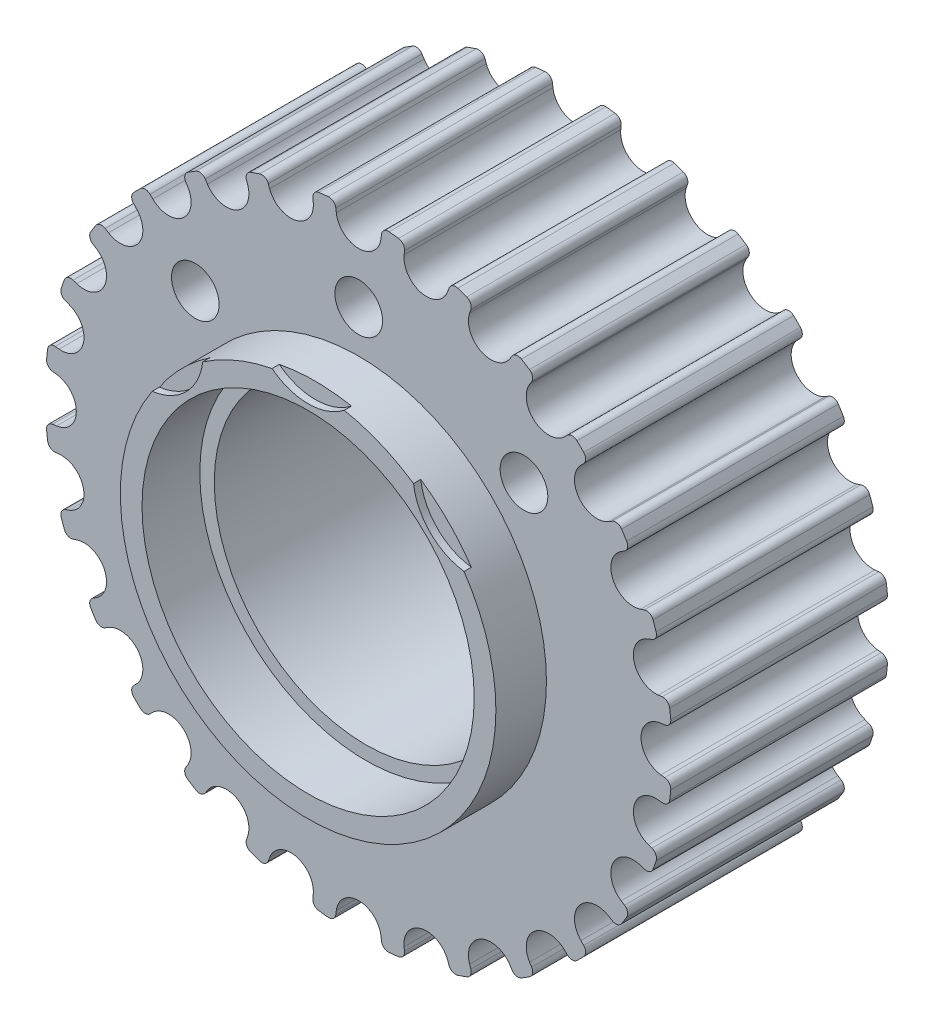
from build123d import *

# Parameters (mm, degrees)
SKETCH_2_R           = 10.5
EXTRUDE_1_DEPTH      = 15
EXTRUDE_2_DEPTH      = 3.5
EXTRUDE_2_DEPTH_BACK = 19.5
SKETCH_12_R          = 13
SKETCH_12_R_2        = 11.5
HOLE_WIZARD_M4_1_D   = 3.3
CUT_EXTRUDE_START    = -0.5
SKETCH_14_R          = 11.5
SKETCH_14_R_2        = 10.5
CUT_EXTRUDE_1_DEPTH  = 0.5
CUT_EXTRUDE_START_2  = 3.5
SKETCH_15_R          = 4.05
CUT_EXTRUDE_2_DEPTH  = 0.5
CUT_EXTRUDE_START_3  = -18
SKETCH_15_2_R        = 4.05
CUT_EXTRUDE_3_DEPTH  = 1.5
EXTRUDE_START        = 0.5
SKETCH_16_R          = 11.5
SKETCH_16_R_2        = 10.5
EXTRUDE_3_DEPTH      = 0.5


with BuildPart() as part:
    # 草图2 → 凸台-拉伸1 (new body)
    with BuildSketch(Plane.XY):
        with BuildLine():
            Line((1.331903556, 20.780403486), (1.298918642, 20.511762921))
            ThreePointArc((1.298918642, 20.511762921), (-0.249453355, 19.141879097), (-1.797825351, 20.511762921))
            Line((-1.797825351, 20.511762921), (-1.830810265, 20.780403486))
            ThreePointArc((-1.830810265, 20.780403486), (-2.006994407, 21.096415396), (-2.353762187, 21.19964565))
            ThreePointArc((-2.353762187, 21.19964565), (-2.679978202, 21.165383749), (-3.00563929, 21.12619674))
            ThreePointArc((-3.00563929, 21.12619674), (-3.320741986, 20.948391594), (-3.422189558, 20.601098103))
            Line((-3.422189558, 20.601098103), (-3.394569322, 20.331853084))
            ThreePointArc((-3.394569322, 20.331853084), (-4.599292572, 18.651769924), (-6.413671477, 19.642762718))
            Line((-6.413671477, 19.642762718), (-6.50560754, 19.897328069))
            ThreePointArc((-6.50560754, 19.897328069), (-6.747693643, 20.166212241), (-7.108738124, 20.189691206))
            ThreePointArc((-7.108738124, 20.189691206), (-7.419151232, 20.083698431), (-7.727927386, 19.973027513))
            ThreePointArc((-7.727927386, 19.973027513), (-7.995564432, 19.729563367), (-8.01718843, 19.36840304))
            Line((-8.01718843, 19.36840304), (-7.930348038, 19.112054636))
            ThreePointArc((-7.930348038, 19.112054636), (-8.731012687, 17.206018527), (-10.720417968, 17.768427773))
            Line((-10.720417968, 17.768427773), (-10.866695121, 17.996152941))
            ThreePointArc((-10.866695121, 17.996152941), (-11.162543977, 18.2044264), (-11.51976088, 18.146976743))
            ThreePointArc((-11.51976088, 18.146976743), (-11.798805672, 17.974568014), (-12.075213567, 17.797962688))
            ThreePointArc((-12.075213567, 17.797962688), (-12.281964525, 17.501047851), (-12.222680631, 17.144130775))
            Line((-12.222680631, 17.144130775), (-12.080974622, 16.913533367))
            ThreePointArc((-12.080974622, 16.913533367), (-12.437432001, 14.877120916), (-14.502106569, 14.982745068))
            Line((-14.502106569, 14.982745068), (-14.695389866, 15.172210962))
            ThreePointArc((-14.695389866, 15.172210962), (-15.030166378, 15.309430006), (-15.365643356, 15.173932493))
            ThreePointArc((-15.365643356, 15.173932493), (-15.599327361, 14.943753103), (-15.829506751, 14.710069098))
            ThreePointArc((-15.829506751, 14.710069098), (-15.965004264, 14.37459212), (-15.82778522, 14.039815608))
            Line((-15.82778522, 14.039815608), (-15.638319326, 13.846532311))
            ThreePointArc((-15.638319326, 13.846532311), (-15.532695174, 11.781857744), (-17.569107624, 11.425400364))
            Line((-17.569107624, 11.425400364), (-17.799705033, 11.567106373))
            ThreePointArc((-17.799705033, 11.567106373), (-18.156622109, 11.626390267), (-18.453536946, 11.41963931))
            ThreePointArc((-18.453536946, 11.41963931), (-18.630142271, 11.143231414), (-18.802551001, 10.864186622))
            ThreePointArc((-18.802551001, 10.864186622), (-18.860000658, 10.506969719), (-18.651727199, 10.211120863))
            Line((-18.651727199, 10.211120863), (-18.424002031, 10.06484371))
            ThreePointArc((-18.424002031, 10.06484371), (-17.861592784, 8.075438429), (-19.767628894, 7.27477378))
            Line((-19.767628894, 7.27477378), (-20.023977298, 7.361614172))
            ThreePointArc((-20.023977298, 7.361614172), (-20.385137624, 7.339990175), (-20.628601771, 7.072353128))
            ThreePointArc((-20.628601771, 7.072353128), (-20.739272689, 6.763576974), (-20.845265464, 6.453163866))
            ThreePointArc((-20.845265464, 6.453163866), (-20.821786499, 6.092119385), (-20.552902327, 5.850033282))
            Line((-20.552902327, 5.850033282), (-20.298336976, 5.75809722))
            ThreePointArc((-20.298336976, 5.75809722), (-19.307344182, 3.943718314), (-20.987427341, 2.738995064))
            Line((-20.987427341, 2.738995064), (-21.25667236, 2.7666153))
            ThreePointArc((-21.25667236, 2.7666153), (-21.603965852, 2.665167728), (-21.781770998, 2.350065032))
            ThreePointArc((-21.781770998, 2.350065032), (-21.820958007, 2.024403944), (-21.855219907, 1.69818793))
            ThreePointArc((-21.855219907, 1.69818793), (-21.751989654, 1.351420149), (-21.435977744, 1.175236007))
            Line((-21.435977744, 1.175236007), (-21.167337179, 1.142251093))
            ThreePointArc((-21.167337179, 1.142251093), (-19.797453355, -0.406120903), (-21.167337179, -1.9544929))
            Line((-21.167337179, -1.9544929), (-21.435977744, -1.987477814))
            ThreePointArc((-21.435977744, -1.987477814), (-21.751989654, -2.163661955), (-21.855219907, -2.510429736))
            ThreePointArc((-21.855219907, -2.510429736), (-21.820958007, -2.83664575), (-21.781770998, -3.162306838))
            ThreePointArc((-21.781770998, -3.162306838), (-21.603965852, -3.477409534), (-21.25667236, -3.578857107))
            Line((-21.25667236, -3.578857107), (-20.987427341, -3.55123687))
            ThreePointArc((-20.987427341, -3.55123687), (-19.307344182, -4.75596012), (-20.298336976, -6.570339026))
            Line((-20.298336976, -6.570339026), (-20.552902327, -6.662275089))
            ThreePointArc((-20.552902327, -6.662275089), (-20.821786499, -6.904361192), (-20.845265464, -7.265405672))
            ThreePointArc((-20.845265464, -7.265405672), (-20.739272689, -7.57581878), (-20.628601771, -7.884594935))
            ThreePointArc((-20.628601771, -7.884594935), (-20.385137624, -8.152231981), (-20.023977298, -8.173855979))
            Line((-20.023977298, -8.173855979), (-19.767628894, -8.087015586))
            ThreePointArc((-19.767628894, -8.087015586), (-17.861592784, -8.887680235), (-18.424002031, -10.877085516))
            Line((-18.424002031, -10.877085516), (-18.651727199, -11.023362669))
            ThreePointArc((-18.651727199, -11.023362669), (-18.860000658, -11.319211525), (-18.802551001, -11.676428428))
            ThreePointArc((-18.802551001, -11.676428428), (-18.630142271, -11.95547322), (-18.453536946, -12.231881116))
            ThreePointArc((-18.453536946, -12.231881116), (-18.156622109, -12.438632073), (-17.799705033, -12.379348179))
            Line((-17.799705033, -12.379348179), (-17.569107624, -12.237642171))
            ThreePointArc((-17.569107624, -12.237642171), (-15.532695174, -12.59409955), (-15.638319326, -14.658774118))
            Line((-15.638319326, -14.658774118), (-15.82778522, -14.852057414))
            ThreePointArc((-15.82778522, -14.852057414), (-15.965004264, -15.186833926), (-15.829506751, -15.522310905))
            ThreePointArc((-15.829506751, -15.522310905), (-15.599327361, -15.755994909), (-15.365643356, -15.9861743))
            ThreePointArc((-15.365643356, -15.9861743), (-15.030166378, -16.121671812), (-14.695389866, -15.984452768))
            Line((-14.695389866, -15.984452768), (-14.502106569, -15.794986874))
            ThreePointArc((-14.502106569, -15.794986874), (-12.437432001, -15.689362722), (-12.080974622, -17.725775173))
            Line((-12.080974622, -17.725775173), (-12.222680631, -17.956372582))
            ThreePointArc((-12.222680631, -17.956372582), (-12.281964525, -18.313289657), (-12.075213567, -18.610204494))
            ThreePointArc((-12.075213567, -18.610204494), (-11.798805672, -18.78680982), (-11.51976088, -18.95921855))
            ThreePointArc((-11.51976088, -18.95921855), (-11.162543977, -19.016668206), (-10.866695121, -18.808394748))
            Line((-10.866695121, -18.808394748), (-10.720417968, -18.58066958))
            ThreePointArc((-10.720417968, -18.58066958), (-8.731012687, -18.018260333), (-7.930348038, -19.924296443))
            Line((-7.930348038, -19.924296443), (-8.01718843, -20.180644846))
            ThreePointArc((-8.01718843, -20.180644846), (-7.995564432, -20.541805173), (-7.727927386, -20.785269319))
            ThreePointArc((-7.727927386, -20.785269319), (-7.419151232, -20.895940238), (-7.108738124, -21.001933013))
            ThreePointArc((-7.108738124, -21.001933013), (-6.747693643, -20.978454047), (-6.50560754, -20.709569876))
            Line((-6.50560754, -20.709569876), (-6.413671477, -20.455004524))
            ThreePointArc((-6.413671477, -20.455004524), (-4.599292572, -19.464011731), (-3.394569322, -21.14409489))
            Line((-3.394569322, -21.14409489), (-3.422189558, -21.413339909))
            ThreePointArc((-3.422189558, -21.413339909), (-3.320741986, -21.7606334), (-3.00563929, -21.938438546))
            ThreePointArc((-3.00563929, -21.938438546), (-2.679978202, -21.977625556), (-2.353762187, -22.011887456))
            ThreePointArc((-2.353762187, -22.011887456), (-2.006994407, -21.908657202), (-1.830810265, -21.592645292))
            Line((-1.830810265, -21.592645292), (-1.797825351, -21.324004727))
            ThreePointArc((-1.797825351, -21.324004727), (-0.249453355, -19.954120903), (1.298918642, -21.324004727))
            Line((1.298918642, -21.324004727), (1.331903556, -21.592645292))
            ThreePointArc((1.331903556, -21.592645292), (1.508087698, -21.908657202), (1.854855478, -22.011887456))
            ThreePointArc((1.854855478, -22.011887456), (2.181071493, -21.977625556), (2.506732581, -21.938438546))
            ThreePointArc((2.506732581, -21.938438546), (2.821835276, -21.7606334), (2.923282849, -21.413339909))
            Line((2.923282849, -21.413339909), (2.895662612, -21.14409489))
            ThreePointArc((2.895662612, -21.14409489), (4.100385862, -19.464011731), (5.914764768, -20.455004524))
            Line((5.914764768, -20.455004524), (6.006700831, -20.709569876))
            ThreePointArc((6.006700831, -20.709569876), (6.248786934, -20.978454047), (6.609831415, -21.001933013))
            ThreePointArc((6.609831415, -21.001933013), (6.920244522, -20.895940238), (7.229020677, -20.785269319))
            ThreePointArc((7.229020677, -20.785269319), (7.496657723, -20.541805173), (7.518281721, -20.180644846))
            Line((7.518281721, -20.180644846), (7.431441329, -19.924296443))
            ThreePointArc((7.431441329, -19.924296443), (8.232105978, -18.018260333), (10.221511258, -18.58066958))
            Line((10.221511258, -18.58066958), (10.367788412, -18.808394748))
            ThreePointArc((10.367788412, -18.808394748), (10.663637267, -19.016668206), (11.020854171, -18.95921855))
            ThreePointArc((11.020854171, -18.95921855), (11.299898962, -18.78680982), (11.576306858, -18.610204494))
            ThreePointArc((11.576306858, -18.610204494), (11.783057816, -18.313289657), (11.723773921, -17.956372582))
            Line((11.723773921, -17.956372582), (11.582067913, -17.725775173))
            ThreePointArc((11.582067913, -17.725775173), (11.938525292, -15.689362722), (14.00319986, -15.794986874))
            Line((14.00319986, -15.794986874), (14.196483156, -15.984452768))
            ThreePointArc((14.196483156, -15.984452768), (14.531259668, -16.121671812), (14.866736647, -15.9861743))
            ThreePointArc((14.866736647, -15.9861743), (15.100420651, -15.755994909), (15.330600042, -15.522310905))
            ThreePointArc((15.330600042, -15.522310905), (15.466097554, -15.186833926), (15.32887851, -14.852057414))
            Line((15.32887851, -14.852057414), (15.139412616, -14.658774118))
            ThreePointArc((15.139412616, -14.658774118), (15.033788465, -12.59409955), (17.070200915, -12.237642171))
            Line((17.070200915, -12.237642171), (17.300798324, -12.379348179))
            ThreePointArc((17.300798324, -12.379348179), (17.657715399, -12.438632073), (17.954630236, -12.231881116))
            ThreePointArc((17.954630236, -12.231881116), (18.131235562, -11.95547322), (18.303644292, -11.676428428))
            ThreePointArc((18.303644292, -11.676428428), (18.361093948, -11.319211525), (18.15282049, -11.023362669))
            Line((18.15282049, -11.023362669), (17.925095322, -10.877085516))
            ThreePointArc((17.925095322, -10.877085516), (17.362686075, -8.887680235), (19.268722185, -8.087015586))
            Line((19.268722185, -8.087015586), (19.525070588, -8.173855979))
            ThreePointArc((19.525070588, -8.173855979), (19.886230915, -8.152231981), (20.129695061, -7.884594935))
            ThreePointArc((20.129695061, -7.884594935), (20.24036598, -7.57581878), (20.346358755, -7.265405672))
            ThreePointArc((20.346358755, -7.265405672), (20.32287979, -6.904361192), (20.053995618, -6.662275089))
            Line((20.053995618, -6.662275089), (19.799430267, -6.570339026))
            ThreePointArc((19.799430267, -6.570339026), (18.808437473, -4.75596012), (20.488520632, -3.55123687))
            Line((20.488520632, -3.55123687), (20.757765651, -3.578857107))
            ThreePointArc((20.757765651, -3.578857107), (21.105059142, -3.477409534), (21.282864289, -3.162306838))
            ThreePointArc((21.282864289, -3.162306838), (21.322051298, -2.83664575), (21.356313198, -2.510429736))
            ThreePointArc((21.356313198, -2.510429736), (21.253082944, -2.163661955), (20.937071035, -1.987477814))
            Line((20.937071035, -1.987477814), (20.66843047, -1.9544929))
            ThreePointArc((20.66843047, -1.9544929), (19.298546645, -0.406120903), (20.66843047, 1.142251093))
            Line((20.66843047, 1.142251093), (20.937071035, 1.175236007))
            ThreePointArc((20.937071035, 1.175236007), (21.253082944, 1.351420149), (21.356313198, 1.69818793))
            ThreePointArc((21.356313198, 1.69818793), (21.322051298, 2.024403944), (21.282864289, 2.350065032))
            ThreePointArc((21.282864289, 2.350065032), (21.105059142, 2.665167728), (20.757765651, 2.7666153))
            Line((20.757765651, 2.7666153), (20.488520632, 2.738995064))
            ThreePointArc((20.488520632, 2.738995064), (18.808437473, 3.943718314), (19.799430267, 5.75809722))
            Line((19.799430267, 5.75809722), (20.053995618, 5.850033282))
            ThreePointArc((20.053995618, 5.850033282), (20.32287979, 6.092119385), (20.346358755, 6.453163866))
            ThreePointArc((20.346358755, 6.453163866), (20.24036598, 6.763576974), (20.129695061, 7.072353128))
            ThreePointArc((20.129695061, 7.072353128), (19.886230915, 7.339990175), (19.525070588, 7.361614172))
            Line((19.525070588, 7.361614172), (19.268722185, 7.27477378))
            ThreePointArc((19.268722185, 7.27477378), (17.362686075, 8.075438429), (17.925095322, 10.06484371))
            Line((17.925095322, 10.06484371), (18.15282049, 10.211120863))
            ThreePointArc((18.15282049, 10.211120863), (18.361093948, 10.506969719), (18.303644292, 10.864186622))
            ThreePointArc((18.303644292, 10.864186622), (18.131235562, 11.143231414), (17.954630236, 11.41963931))
            ThreePointArc((17.954630236, 11.41963931), (17.657715399, 11.626390267), (17.300798324, 11.567106373))
            Line((17.300798324, 11.567106373), (17.070200915, 11.425400364))
            ThreePointArc((17.070200915, 11.425400364), (15.033788465, 11.781857744), (15.139412616, 13.846532311))
            Line((15.139412616, 13.846532311), (15.32887851, 14.039815608))
            ThreePointArc((15.32887851, 14.039815608), (15.466097554, 14.37459212), (15.330600042, 14.710069098))
            ThreePointArc((15.330600042, 14.710069098), (15.100420651, 14.943753103), (14.866736647, 15.173932493))
            ThreePointArc((14.866736647, 15.173932493), (14.531259668, 15.309430006), (14.196483156, 15.172210962))
            Line((14.196483156, 15.172210962), (14.00319986, 14.982745068))
            ThreePointArc((14.00319986, 14.982745068), (11.938525292, 14.877120916), (11.582067913, 16.913533367))
            Line((11.582067913, 16.913533367), (11.723773921, 17.144130775))
            ThreePointArc((11.723773921, 17.144130775), (11.783057816, 17.501047851), (11.576306858, 17.797962688))
            ThreePointArc((11.576306858, 17.797962688), (11.299898962, 17.974568014), (11.020854171, 18.146976743))
            ThreePointArc((11.020854171, 18.146976743), (10.663637267, 18.2044264), (10.367788412, 17.996152941))
            Line((10.367788412, 17.996152941), (10.221511258, 17.768427773))
            ThreePointArc((10.221511258, 17.768427773), (8.232105978, 17.206018527), (7.431441329, 19.112054636))
            Line((7.431441329, 19.112054636), (7.518281721, 19.36840304))
            ThreePointArc((7.518281721, 19.36840304), (7.496657723, 19.729563367), (7.229020677, 19.973027513))
            ThreePointArc((7.229020677, 19.973027513), (6.920244522, 20.083698431), (6.609831415, 20.189691206))
            ThreePointArc((6.609831415, 20.189691206), (6.248786934, 20.166212241), (6.006700831, 19.897328069))
            Line((6.006700831, 19.897328069), (5.914764768, 19.642762718))
            ThreePointArc((5.914764768, 19.642762718), (4.100385862, 18.651769924), (2.895662612, 20.331853084))
            Line((2.895662612, 20.331853084), (2.923282849, 20.601098103))
            ThreePointArc((2.923282849, 20.601098103), (2.821835276, 20.948391594), (2.506732581, 21.12619674))
            ThreePointArc((2.506732581, 21.12619674), (2.181071493, 21.165383749), (1.854855478, 21.19964565))
            ThreePointArc((1.854855478, 21.19964565), (1.508087698, 21.096415396), (1.331903556, 20.780403486))
        make_face()
        with Locations((-0.245789015, -0.367741944)):
            Circle(SKETCH_2_R, mode=Mode.SUBTRACT)
    extrude(amount=EXTRUDE_1_DEPTH)


with BuildPart() as part_1:
    # Move Body 1: moved
    add(part.part.moved(Location((-21.775119277, 0, 0))))

    # 草图12 → 凸台-拉伸2 (add, two sides: drawn at the far end of the back side and taken through both)
    with BuildSketch(Plane.XY.offset(15).offset(-EXTRUDE_2_DEPTH_BACK)):
        with Locations((-22.024572632, -0.309578045)):
            Circle(SKETCH_12_R)
        with Locations((-22.024572632, -0.309578045)):
            Circle(SKETCH_12_R_2, mode=Mode.SUBTRACT)
    extrude(amount=EXTRUDE_2_DEPTH + EXTRUDE_2_DEPTH_BACK)

    # M4 螺纹孔1 (through all)
    with Locations(Plane(origin=(-33.334616791, 10.945966555, 15), x_dir=(1, 0, 0), z_dir=(0, 0, 1))):
        with Locations((0, 0), (11.313708499, 4.686291501), (22.755337645, -0.129383643)):
            Hole(HOLE_WIZARD_M4_1_D / 2)

    # 草图14 → 切除-拉伸1 (cut)
    with BuildSketch(Plane.XY.offset(15).offset(CUT_EXTRUDE_START)):
        with Locations((-22.024572632, -0.309578045)):
            Circle(SKETCH_14_R)
        with Locations((-22.020908292, -0.367741944)):
            Circle(SKETCH_14_R_2, mode=Mode.SUBTRACT)
    extrude(amount=CUT_EXTRUDE_1_DEPTH, mode=Mode.SUBTRACT)

    # 草图15 → 切除-拉伸2 (cut)
    with BuildSketch(Plane.XY.offset(15).offset(CUT_EXTRUDE_START_2)):
        with Locations((-22.020908292, 15.632258056)):
            Circle(SKETCH_15_R)
        with Locations((-10.707199793, 10.945966555)):
            Circle(SKETCH_15_R)
        with Locations((-33.334616791, 10.945966555)):
            Circle(SKETCH_15_R)
    extrude(amount=-CUT_EXTRUDE_2_DEPTH, mode=Mode.SUBTRACT)

    # 草图15<2> → 切除-拉伸3 (cut)
    with BuildSketch(Plane.XY.offset(15).offset(CUT_EXTRUDE_START_3)):
        with Locations((-22.020908292, 15.632258056)):
            Circle(SKETCH_15_2_R)
        with Locations((-10.707199793, 10.945966555)):
            Circle(SKETCH_15_2_R)
        with Locations((-33.334616791, 10.945966555)):
            Circle(SKETCH_15_2_R)
    extrude(amount=-CUT_EXTRUDE_3_DEPTH, mode=Mode.SUBTRACT)

    # 草图16 → 凸台-拉伸3 (add)
    with BuildSketch(Plane(origin=(0, 0, 0), x_dir=(-1, 0, 0), z_dir=(0, 0, -1)).offset(EXTRUDE_START)):
        with Locations(Location((22.024572632, -0.309578045, 0), (0, 0, 180))):
            Circle(SKETCH_16_R)
        with Locations((22.020908292, -0.367741944)):
            Circle(SKETCH_16_R_2, mode=Mode.SUBTRACT)
    extrude(amount=-EXTRUDE_3_DEPTH)


solid = part_1.part
